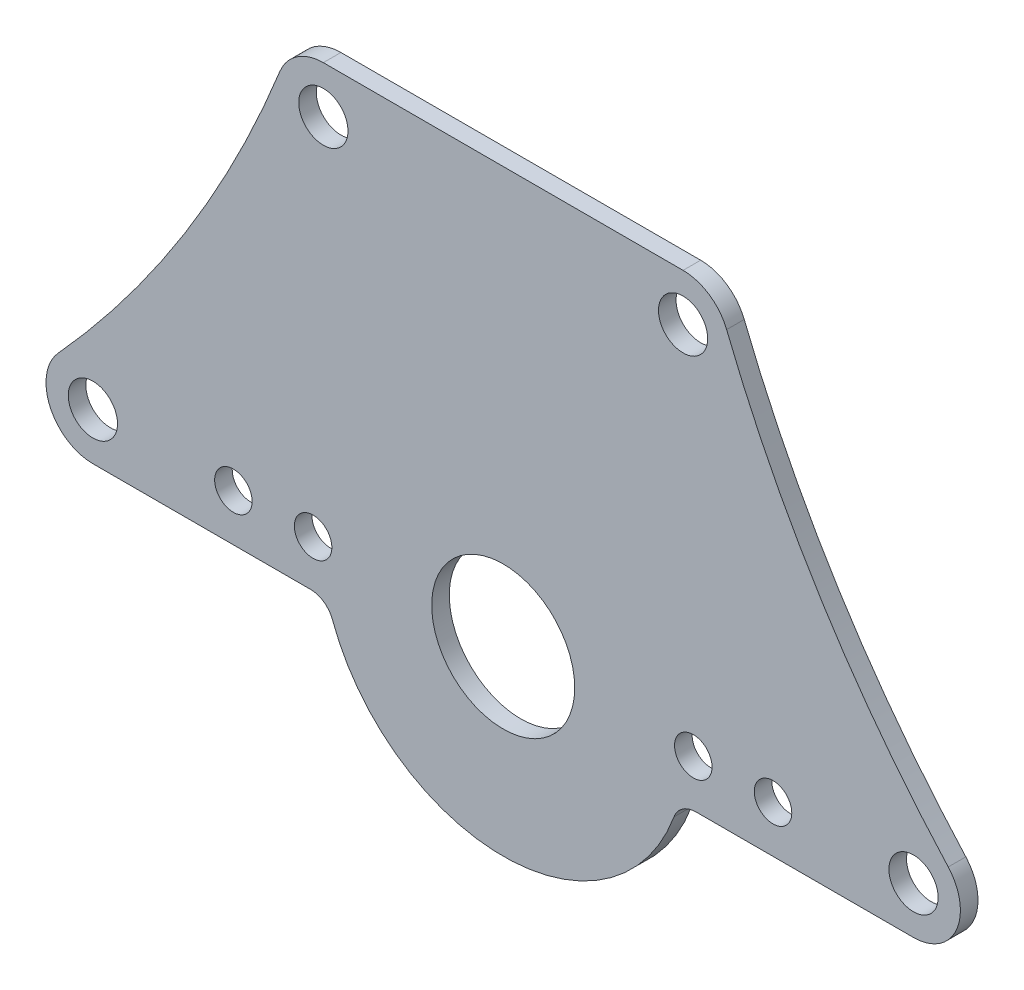
from build123d import *

# Parameters (mm, degrees)
SKETCH_1_R          = 2.1
SKETCH_1_R_2        = 6.1
EXTRUDE_1_DEPTH     = 1.5
SKETCH_2_R          = 6.1
SKETCH_2_R_2        = 1.6
CUT_EXTRUDE_1_DEPTH = 53.758885508
FILLET_1_R          = 2


with BuildPart() as part:
    # ｽｹｯﾁ1 → ﾎﾞｽ - 押し出し1 (new body)
    with BuildSketch(Plane.XY):
        with BuildLine():
            ThreePointArc((-37.95979357, -17.309345429), (-38.658047176, -21.61823696), (-35, -24))
            Line((-35, -24), (-14.974979132, -24))
            ThreePointArc((-14.974979132, -24), (0, -35.5), (14.974979132, -24))
            Line((14.974979132, -24), (35, -24))
            ThreePointArc((35, -24), (38.658047176, -21.61823696), (37.95979357, -17.309345429))
            ThreePointArc((37.95979357, -17.309345429), (27.149823207, -3.034907568), (19.058822549, 12.938531129))
            ThreePointArc((19.058822549, 12.938531129), (17.587655142, 14.768604061), (15.342990138, 15.45779162))
            Line((15.342990138, 15.45779162), (-15.342990138, 15.45779162))
            ThreePointArc((-15.342990138, 15.45779162), (-17.587655142, 14.768604061), (-19.058822549, 12.938531129))
            ThreePointArc((-19.058822549, 12.938531129), (-27.149823207, -3.034907568), (-37.95979357, -17.309345429))
        make_face()
        with Locations((-35, -20)):
            Circle(SKETCH_1_R, mode=Mode.SUBTRACT)
        with Locations((0, -20)):
            Circle(SKETCH_1_R_2, mode=Mode.SUBTRACT)
        with Locations((35, -20)):
            Circle(SKETCH_1_R, mode=Mode.SUBTRACT)
        with Locations((-15.342990138, 11.45779162)):
            Circle(SKETCH_1_R, mode=Mode.SUBTRACT)
        with Locations((15.342990138, 11.45779162)):
            Circle(SKETCH_1_R, mode=Mode.SUBTRACT)
    extrude(amount=EXTRUDE_1_DEPTH)

    # ｽｹｯﾁ2 → ｶｯﾄ - 押し出し1 (cut, through all)
    with BuildSketch(Plane.XY.offset(1.5)):
        with Locations((0, -20)):
            Circle(SKETCH_2_R)
        with Locations((23.015, -20)):
            Circle(SKETCH_2_R_2)
        with Locations(Location((-23.015, -20, 0), (0, 0, 180))):
            Circle(SKETCH_2_R_2)
        with Locations((16.215, -20)):
            Circle(SKETCH_2_R_2)
        with Locations(Location((-16.215, -20, 0), (0, 0, 180))):
            Circle(SKETCH_2_R_2)
    extrude(amount=-CUT_EXTRUDE_1_DEPTH, mode=Mode.SUBTRACT)

    # ﾌｨﾚｯﾄ1
    fillet_1_edges = [part.edges().sort_by_distance(p)[0] for p in [
        (-14.974979132, -24, 0.75),
        (14.974979132, -24, 0.75),
    ]]
    fillet(fillet_1_edges, radius=FILLET_1_R)


solid = part.part
